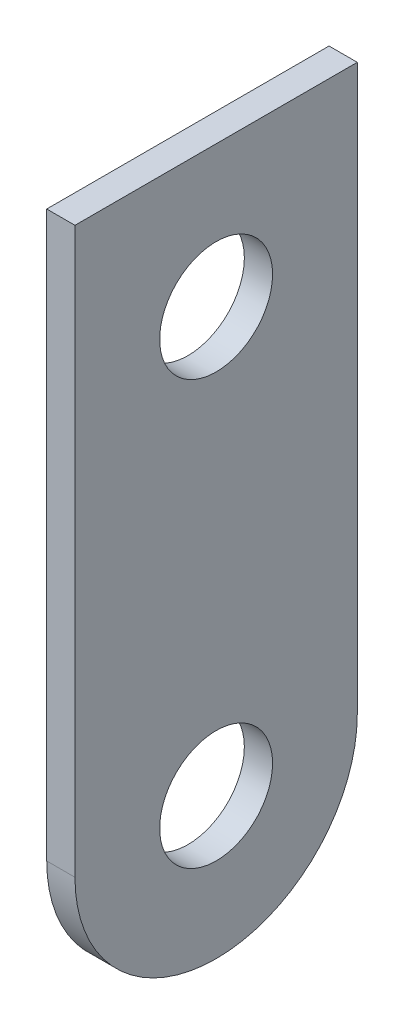
from build123d import *

# Parameters (mm, degrees)
SKETCH1_R           = 10
BOSS_EXTRUDE1_DEPTH = 5


with BuildPart() as part:
    # Sketch1 → Boss-Extrude1 (new body)
    with BuildSketch(Plane(origin=(0, 0, 0), x_dir=(0, 0, -1), z_dir=(1, 0, 0))):
        with BuildLine():
            Line((50, 150), (0, 150))
            Line((0, 150), (0, 50))
            ThreePointArc((0, 50), (25, 25), (50, 50))
            Line((50, 50), (50, 150))
        make_face()
        with Locations((25, 50)):
            Circle(SKETCH1_R, mode=Mode.SUBTRACT)
        with Locations((25, 125)):
            Circle(SKETCH1_R, mode=Mode.SUBTRACT)
    extrude(amount=BOSS_EXTRUDE1_DEPTH)


solid = part.part
